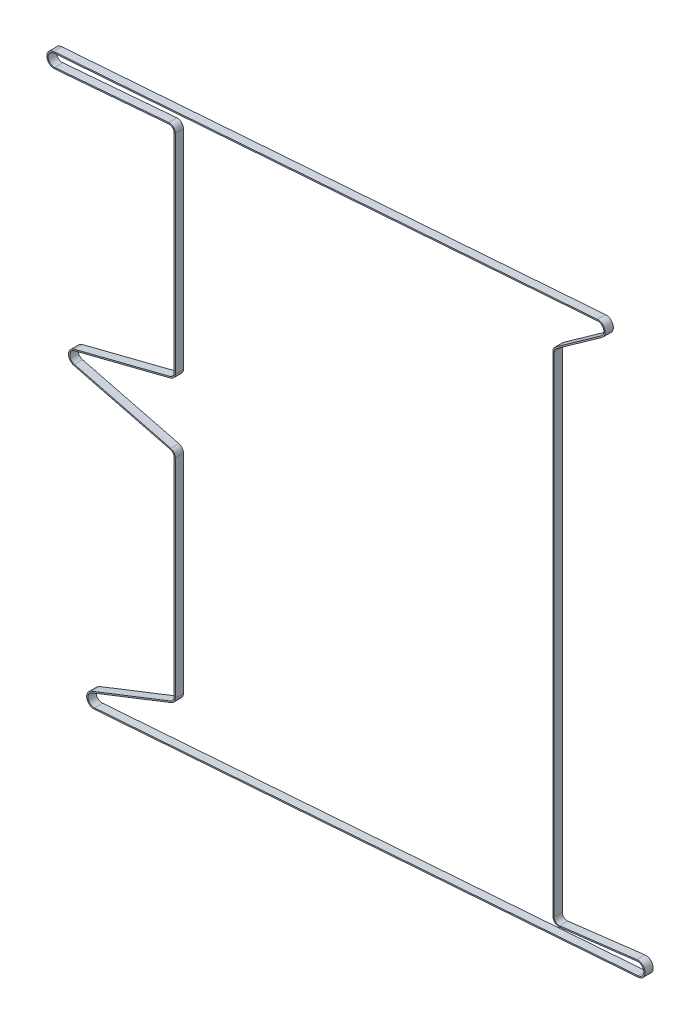
from build123d import *

# Parameters (mm, degrees)
EXTRUDE_1_DEPTH = 4.5


with BuildPart() as part:
    # Эскиз2 → Вытянуть-Тонкостенный1 (new, symmetric)
    with BuildSketch(Plane.XY):
        with BuildLine():
            Line((5.3, 230), (5.3, 0))
            ThreePointArc((5.3, 0), (4.183794955, -3.253591827), (1.305335933, -5.136740027))
            Line((1.305335933, -5.136740027), (-104.994947369, -32.149510525))
            ThreePointArc((-104.994947369, -32.149510525), (-111.1, -40), (-104.994947369, -47.850489475))
            Line((-104.994947369, -47.850489475), (1.305335933, -74.863259973))
            ThreePointArc((1.305335933, -74.863259973), (4.183794955, -76.746408173), (5.3, -80))
            Line((5.3, -80), (5.3, -310))
            ThreePointArc((5.3, -310), (4.379504294, -312.98495262), (1.937757682, -314.933061439))
            Line((1.937757682, -314.933061439), (-85.961478722, -349.460792895))
            ThreePointArc((-85.961478722, -349.460792895), (-90.898089189, -358.797272144), (-82.407590787, -365.078307454))
            Line((-82.407590787, -365.078307454), (517.592409213, -321.078307454))
            ThreePointArc((517.592409213, -321.078307454), (525.062194527, -312.218322694), (516.029484483, -304.958352182))
            Line((516.029484483, -304.958352182), (430.655423427, -315.261818943))
            ThreePointArc((430.655423427, -315.261818943), (426.504406414, -313.965832319), (424.720394755, -310))
            Line((424.720394755, -310), (424.720394755, 230))
            ThreePointArc((424.720394755, 230), (425.310455419, 232.430323322), (426.949251906, 234.319500156))
            Line((426.949251906, 234.319500156), (477.693633412, 270.398499762))
            ThreePointArc((477.693633412, 270.398499762), (480.620970965, 279.744230593), (472.407590787, 285.078307454))
            Line((472.407590787, 285.078307454), (-127.592409213, 241.078307454))
            ThreePointArc((-127.592409213, 241.078307454), (-135.075604128, 232.371813747), (-126.336049032, 224.927257646))
            Line((-126.336049032, 224.927257646), (-0.434437053, 235.28216475))
            ThreePointArc((-0.434437053, 235.28216475), (3.590785681, 233.898237831), (5.3, 230))
        make_face()
        with BuildLine():
            Line((6.7, 230), (6.7, 0))
            ThreePointArc((6.7, 0), (5.288948339, -4.113031178), (1.650141651, -6.493614751))
            Line((1.650141651, -6.493614751), (-104.650141651, -33.506385249))
            ThreePointArc((-104.650141651, -33.506385249), (-109.7, -40), (-104.650141651, -46.493614751))
            Line((-104.650141651, -46.493614751), (1.650141651, -73.506385249))
            ThreePointArc((1.650141651, -73.506385249), (5.288948339, -75.886968822), (6.7, -80))
            Line((6.7, -80), (6.7, -310))
            ThreePointArc((6.7, -310), (5.536354485, -313.77343067), (2.449618202, -316.236134272))
            Line((2.449618202, -316.236134272), (-85.449618202, -350.763865728))
            ThreePointArc((-85.449618202, -350.763865728), (-89.532987354, -358.486632515), (-82.509982503, -363.682056783))
            Line((-82.509982503, -363.682056783), (517.490017497, -319.682056783))
            ThreePointArc((517.490017497, -319.682056783), (523.668728806, -312.353427414), (516.197227906, -306.34826662))
            Line((516.197227906, -306.34826662), (430.82316685, -316.65173338))
            ThreePointArc((430.82316685, -316.65173338), (425.575654776, -315.013410667), (423.320394755, -310))
            Line((423.320394755, -310), (423.320394755, 230))
            ThreePointArc((423.320394755, 230), (424.0663205, 233.07229552), (426.138006625, 235.460500197))
            Line((426.138006625, 235.460500197), (476.882388131, 271.539499803))
            ThreePointArc((476.882388131, 271.539499803), (479.303766107, 279.269919132), (472.509982503, 283.682056783))
            Line((472.509982503, 283.682056783), (-127.490017497, 239.682056783))
            ThreePointArc((-127.490017497, 239.682056783), (-133.679820698, 232.480389148), (-126.450805989, 226.322546448))
            Line((-126.450805989, 226.322546448), (-0.549194011, 236.677453552))
            ThreePointArc((-0.549194011, 236.677453552), (4.539295107, 234.927961032), (6.7, 230))
        make_face(mode=Mode.SUBTRACT)
    extrude(amount=EXTRUDE_1_DEPTH, both=True)


solid = part.part
